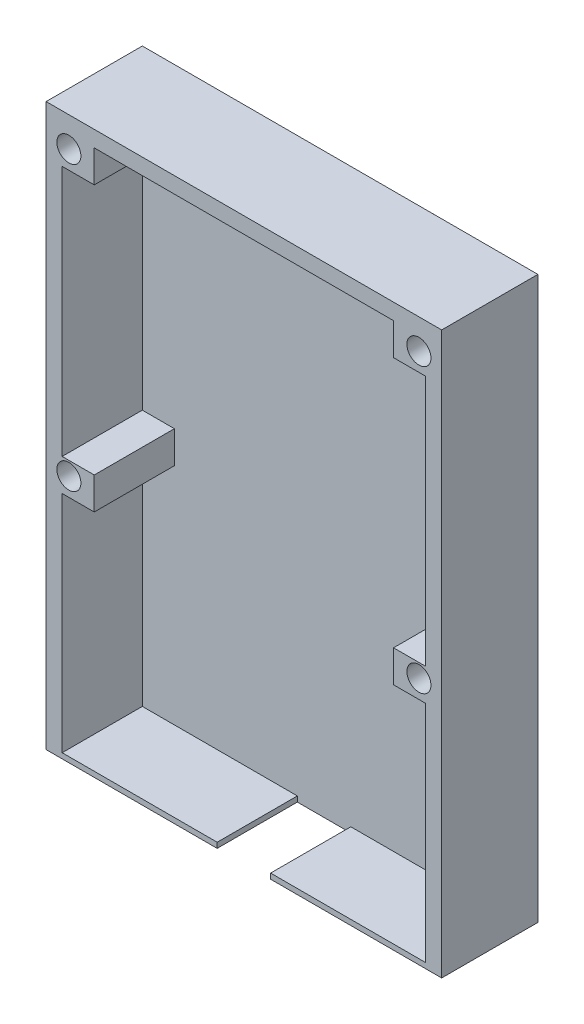
from build123d import *

# Parameters (mm, degrees)
ESQUISSE1_W                          = 74
ESQUISSE1_H                          = 105
BOSS_EXTRU_1_DEPTH                   = 18
ESQUISSE2_W                          = 68
ESQUISSE2_H                          = 99
ENL_V_MAT_EXTRU_1_DEPTH              = 15
ESQUISSE3_W                          = 6
ESQUISSE3_H                          = 6
BOSS_EXTRU_2_DEPTH                   = 15
D_GAGEMENT_M41_D                     = 4.5
ESQUISSE7_W                          = 10
ESQUISSE7_H                          = 30
ENL_V_MAT_EXTRU_2_DEPTH              = 15
R_P_TITION_LIN_AIRE3_COUNT           = 2
R_P_TITION_LIN_AIRE3_PITCH           = 53
R_P_TITION_LIN_AIRE3_COPY_1_SKETCH_W = 6
R_P_TITION_LIN_AIRE3_COPY_1_SKETCH_H = 6
R_P_TITION_LIN_AIRE3_COPY_1_DEPTH    = 15
R_P_TITION_LIN_AIRE3_COPY_2_D        = 4.5
ESQUISSE8_W                          = 68
ESQUISSE8_H                          = 33.530286581
ENL_V_MAT_EXTRU_3_DEPTH              = 2


with BuildPart() as part:
    # Esquisse1 → Boss.-Extru.1 (new body)
    with BuildSketch(Plane.XY):
        Rectangle(ESQUISSE1_W, ESQUISSE1_H)
    extrude(amount=BOSS_EXTRU_1_DEPTH)

    # Esquisse2 → Enlèv. mat.-Extru.1 (cut)
    with BuildSketch(Plane.XY.offset(18)):
        Rectangle(ESQUISSE2_W, ESQUISSE2_H)
    extrude(amount=-ENL_V_MAT_EXTRU_1_DEPTH, mode=Mode.SUBTRACT)

    # Esquisse3 → Boss.-Extru.2 (add)
    with BuildSketch(Plane.XY.offset(18)):
        with Locations((-31, 46.5)):
            Rectangle(ESQUISSE3_W, ESQUISSE3_H)
    boss_extru_2 = extrude(amount=-BOSS_EXTRU_2_DEPTH)

    # Dégagement M41 (through all)
    with Locations(Plane.XY.offset(18)):
        with Locations((-32.745076206, 46.926751476)):
            d_gagement_m41 = Hole(D_GAGEMENT_M41_D / 2)

    # Esquisse7 → Enlèv. mat.-Extru.2 (cut)
    with BuildSketch(Plane.XZ.offset(52.5)):
        with Locations((0, 18)):
            Rectangle(ESQUISSE7_W, ESQUISSE7_H)
    extrude(amount=-ENL_V_MAT_EXTRU_2_DEPTH, mode=Mode.SUBTRACT)

    # Symétrie5: Boss.-Extru.2, Dégagement M41 across plane
    add(boss_extru_2.mirror(Plane(origin=(0, 0, 0), x_dir=(0, 0, 1), z_dir=(1, 0, 0))))
    add(d_gagement_m41.mirror(Plane(origin=(0, 0, 0), x_dir=(0, 0, 1), z_dir=(1, 0, 0))), mode=Mode.SUBTRACT)

    # Répétition linéaire3: Boss.-Extru.2, Dégagement M41 ×2
    with Locations(*[(0, -i * R_P_TITION_LIN_AIRE3_PITCH, 0) for i in range(1, R_P_TITION_LIN_AIRE3_COUNT)]):
        add(boss_extru_2)
        add(d_gagement_m41, mode=Mode.SUBTRACT)

    # Répétition linéaire3 copy 1 sketch → Répétition linéaire3 copy 1 (add)
    with BuildSketch(Plane(origin=(0, -53, 18), x_dir=(-1, 0, 0), z_dir=(0, 0, 1))):
        with Locations((-31, -46.5)):
            Rectangle(R_P_TITION_LIN_AIRE3_COPY_1_SKETCH_W, R_P_TITION_LIN_AIRE3_COPY_1_SKETCH_H)
    extrude(amount=-R_P_TITION_LIN_AIRE3_COPY_1_DEPTH)

    # Répétition linéaire3 copy 2 (through all)
    with Locations(Plane(origin=(0, -53, 18), x_dir=(-1, 0, 0), z_dir=(0, 0, 1))):
        with Locations((-32.745076206, -46.926751476)):
            Hole(R_P_TITION_LIN_AIRE3_COPY_2_D / 2)

    # Esquisse8 → Enlèv. mat.-Extru.3 (cut)
    with BuildSketch(Plane(origin=(0, -49.5, 0), x_dir=(1, 0, 0), z_dir=(0, 1, 0))):
        with Locations((0, -19.765143291)):
            Rectangle(ESQUISSE8_W, ESQUISSE8_H)
    extrude(amount=-ENL_V_MAT_EXTRU_3_DEPTH, mode=Mode.SUBTRACT)


solid = part.part
